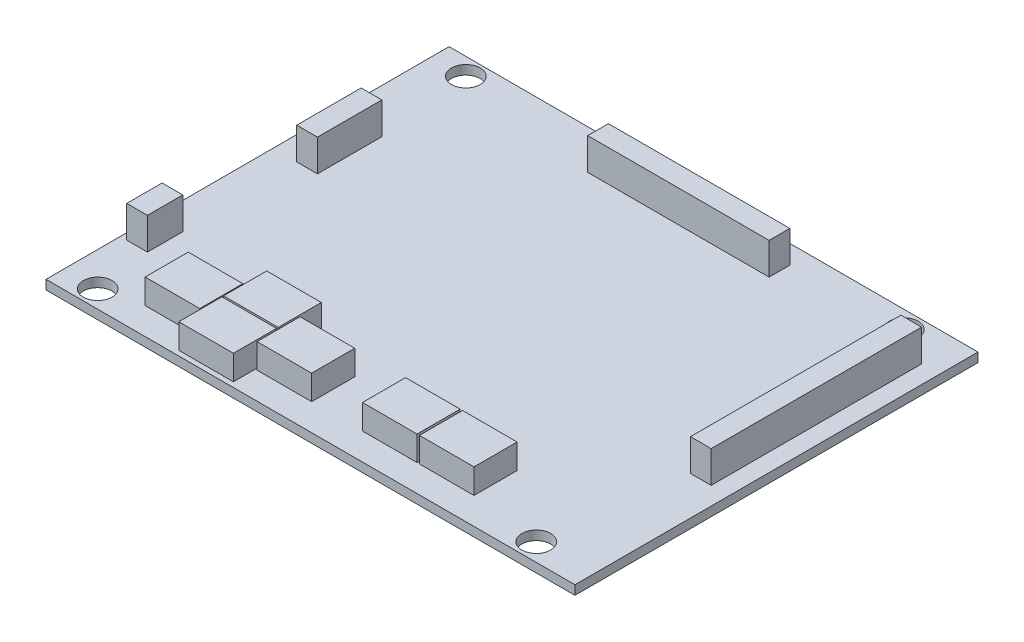
from build123d import *

# Parameters (mm, degrees)
SKETCH1_W             = 92
SKETCH1_H             = 70.1
SKETCH1_R             = 2.5
Y_PCB_EXTR_DEPTH      = 1.6
SKETCH2_W             = 31.55
SKETCH2_H             = 3.6
SKETCH2_W_2           = 3.6
SKETCH2_H_2           = 11.2
SKETCH2_H_3           = 6.15
SKETCH2_H_4           = 36.6
Y_HEADERS_EXTR_DEPTH  = 5.54
SKETCH3_W             = 9.5
SKETCH3_H             = 7.5
Y_SWITCHES_EXTR_DEPTH = 4.3


with BuildPart() as part:
    # Sketch1 → Y+ PCB extr (new body)
    with BuildSketch(Plane(origin=(0, 0, 0), x_dir=(1, 0, 0), z_dir=(0, 1, 0))):
        with Locations((46, 35.05)):
            Rectangle(SKETCH1_W, SKETCH1_H)
        with Locations(Location((5.92, 3.07, 0), (0, 0, 270))):
            Circle(SKETCH1_R, mode=Mode.SUBTRACT)
        with Locations(Location((82.16, 3.11, 0), (0, 0, 270))):
            Circle(SKETCH1_R, mode=Mode.SUBTRACT)
        with Locations(Location((82.16, 67.05, 0), (0, 0, 270))):
            Circle(SKETCH1_R, mode=Mode.SUBTRACT)
        with Locations(Location((5.92, 67.1, 0), (0, 0, 270))):
            Circle(SKETCH1_R, mode=Mode.SUBTRACT)
    extrude(amount=Y_PCB_EXTR_DEPTH)

    # Sketch2 → Y+ headers extr (add)
    with BuildSketch(Plane(origin=(0, 1.6, 0), x_dir=(1, 0, 0), z_dir=(0, 1, 0))):
        with Locations((46.775, 65.02)):
            Rectangle(SKETCH2_W, SKETCH2_H)
        with Locations((5.92, 45.09)):
            Rectangle(SKETCH2_W_2, SKETCH2_H_2)
        with Locations((2.92, 15.995)):
            Rectangle(SKETCH2_W_2, SKETCH2_H_3)
        with Locations((87.08, 45.11)):
            Rectangle(SKETCH2_W_2, SKETCH2_H_4)
    extrude(amount=Y_HEADERS_EXTR_DEPTH)

    # Sketch3 → Y+ switches extr (add)
    with BuildSketch(Plane(origin=(0, 1.6, 0), x_dir=(1, 0, 0), z_dir=(0, 1, 0))):
        with Locations((17.32, 8.42)):
            Rectangle(SKETCH3_W, SKETCH3_H)
        with Locations((26.98, 4.61)):
            Rectangle(SKETCH3_W, SKETCH3_H)
        with Locations((26.98, 12.41)):
            Rectangle(SKETCH3_W, SKETCH3_H)
        with Locations((36.78, 8.42)):
            Rectangle(SKETCH3_W, SKETCH3_H)
        with Locations((55.12, 8.42)):
            Rectangle(SKETCH3_W, SKETCH3_H)
        with Locations((65.02, 8.42)):
            Rectangle(SKETCH3_W, SKETCH3_H)
    extrude(amount=Y_SWITCHES_EXTR_DEPTH)


solid = part.part
